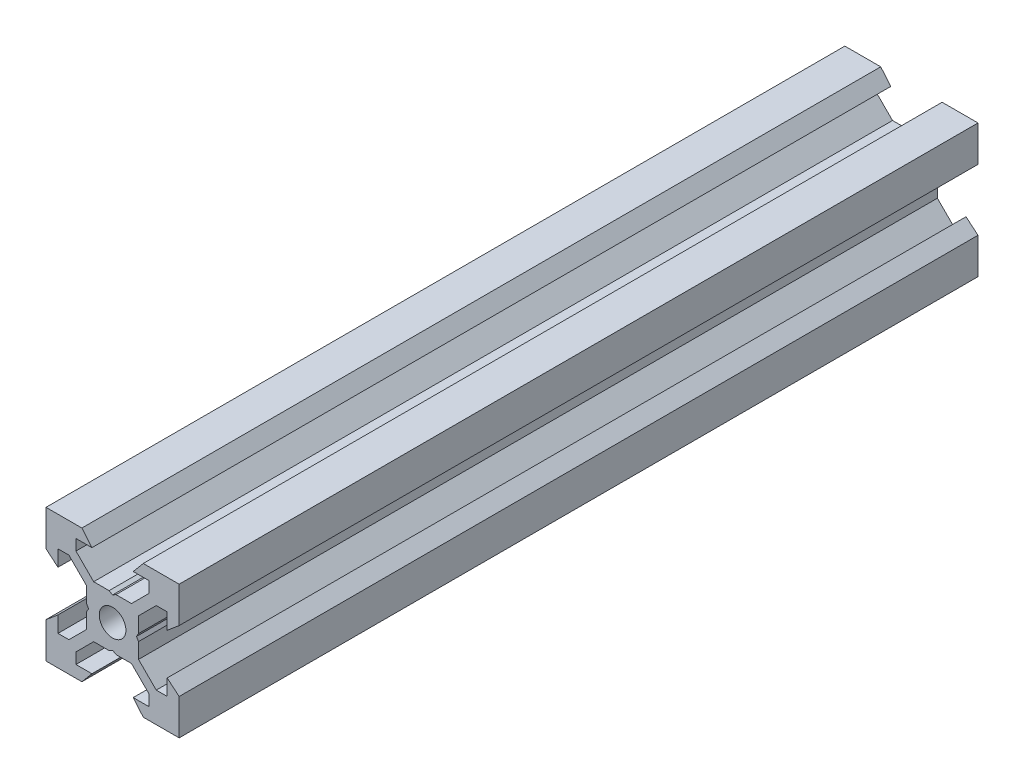
from build123d import *

# Parameters (mm, degrees)
SKETCH1_R           = 2
BOSS_EXTRUDE1_DEPTH = 60


with BuildPart() as part:
    # Sketch1 → Boss-Extrude1 (new, symmetric)
    with BuildSketch(Plane.XY):
        Polygon((10, 10), (10, 4.610379336), (8.2, 3.1), (8.2, 5.5), (6.560660172, 5.5), (3.9, 2.839339828), (3.9, 0.519615242), (3.6, 0), (3.9, -0.519615242), (3.9, -2.839339828), (6.560660172, -5.5), (8.2, -5.5), (8.2, -3.1), (10, -4.610379336), (10, -10), (4.610379336, -10), (3.1, -8.2), (5.5, -8.2), (5.5, -6.560660172), (2.839339828, -3.9), (0.519615242, -3.9), (0, -3.6), (-0.519615242, -3.9), (-2.839339828, -3.9), (-5.5, -6.560660172), (-5.5, -8.2), (-3.1, -8.2), (-4.610379336, -10), (-10, -10), (-10, -4.610379336), (-8.2, -3.1), (-8.2, -5.5), (-6.560660172, -5.5), (-3.9, -2.839339828), (-3.9, -0.519615242), (-3.6, 0), (-3.9, 0.519615242), (-3.9, 2.839339828), (-6.560660172, 5.5), (-8.2, 5.5), (-8.2, 3.1), (-10, 4.610379336), (-10, 10), (-4.610379336, 10), (-3.1, 8.2), (-5.5, 8.2), (-5.5, 6.560660172), (-2.839339828, 3.9), (-0.519615242, 3.9), (0, 3.6), (0.519615242, 3.9), (2.839339828, 3.9), (5.5, 6.560660172), (5.5, 8.2), (3.1, 8.2), (4.610379336, 10), align=None)
        Circle(SKETCH1_R, mode=Mode.SUBTRACT)
    extrude(amount=BOSS_EXTRUDE1_DEPTH, both=True)


solid = part.part
